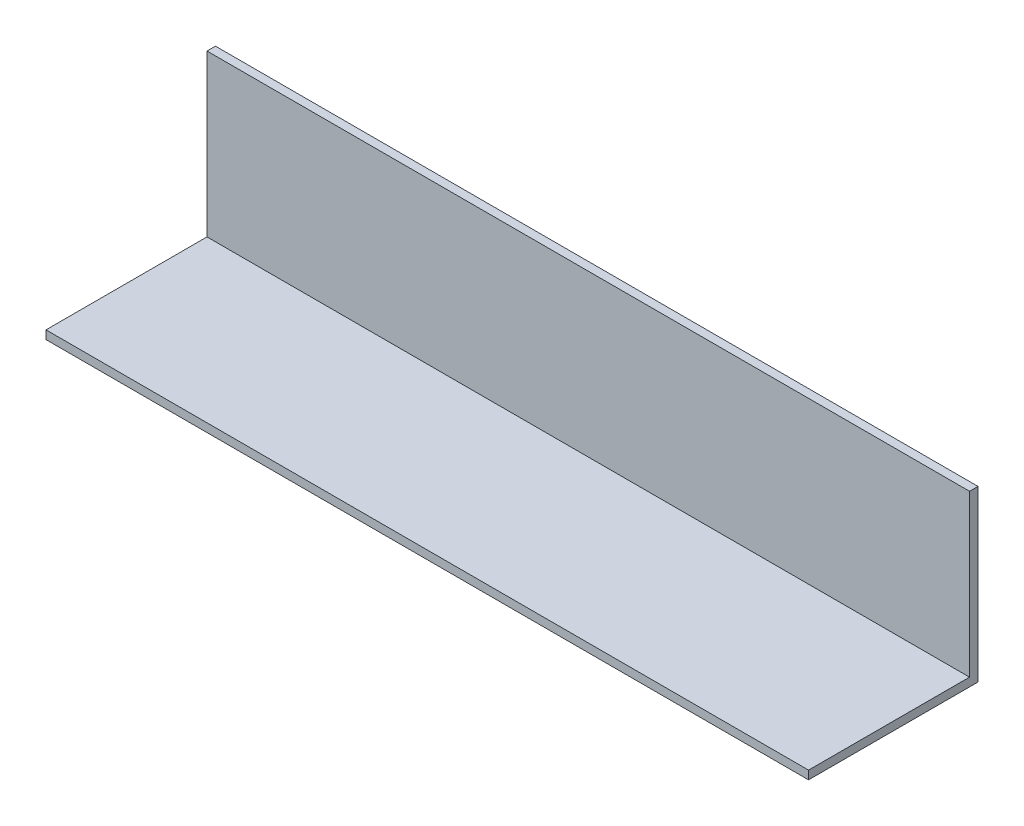
from build123d import *

# Parameters (mm, degrees)
SKETCH1_W           = 457.2
SKETCH1_H           = 101.6
BOSS_EXTRUDE1_DEPTH = 5.08
SKETCH1_4_W         = 457.2
SKETCH1_4_H         = 5.08
BOSS_EXTRUDE2_DEPTH = 101.6


with BuildPart() as part:
    # Sketch1 → Boss-Extrude1 (new body)
    with BuildSketch(Plane.XY):
        Rectangle(SKETCH1_W, SKETCH1_H)
    extrude(amount=BOSS_EXTRUDE1_DEPTH)

    # Sketch1<4> → Boss-Extrude2 (add)
    with BuildSketch(Plane.XY):
        with Locations((0, -48.26)):
            Rectangle(SKETCH1_4_W, SKETCH1_4_H)
    extrude(amount=BOSS_EXTRUDE2_DEPTH)


solid = part.part
